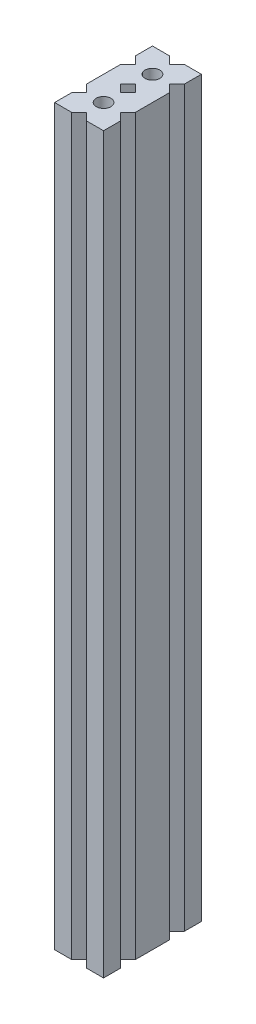
from build123d import *

# Parameters (mm, degrees)
SKIZZE1_W                       = 20
SKIZZE1_H                       = 40
AUFSATZ_LINEAR_AUSTRAGEN1_DEPTH = 300
SCHNITT_LINEAR_AUSTRAGEN1_DEPTH = 304.315017762
SKIZZE3_R                       = 3
SCHNITT_LINEAR_AUSTRAGEN2_DEPTH = 304.315017762


with BuildPart() as part:
    # Skizze1 → Aufsatz-Linear austragen1 (new body)
    with BuildSketch(Plane(origin=(0, 0, 0), x_dir=(1, 0, 0), z_dir=(0, 1, 0))):
        with Locations((10, 20)):
            Rectangle(SKIZZE1_W, SKIZZE1_H)
    extrude(amount=AUFSATZ_LINEAR_AUSTRAGEN1_DEPTH)

    # Skizze2 → Schnitt-Linear austragen1 (cut, through all)
    with BuildSketch(Plane(origin=(0, 300, 0), x_dir=(1, 0, 0), z_dir=(0, 1, 0))):
        Polygon((3, 30), (0, 33), (0, 27), align=None)
        Polygon((13, 40), (7, 40), (10, 37), align=None)
        Polygon((20, 27), (20, 33), (17, 30), align=None)
        Polygon((13, 20), (10, 17), (7, 20), align=None)
        Polygon((7, 20), (10, 23), (13, 20), align=None)
        Polygon((20, 7), (20, 13), (17, 10), align=None)
        Polygon((3, 10), (0, 13), (0, 7), align=None)
        Polygon((10, 3), (7, 0), (13, 0), align=None)
    extrude(amount=-SCHNITT_LINEAR_AUSTRAGEN1_DEPTH, mode=Mode.SUBTRACT)

    # Skizze3 → Schnitt-Linear austragen2 (cut, through all)
    with BuildSketch(Plane.XZ):
        with Locations(Location((10, -10, 0), (0, 0, 270))):
            Circle(SKIZZE3_R)
        with Locations(Location((10, -30, 0), (0, 0, 90))):
            Circle(SKIZZE3_R)
    extrude(amount=-SCHNITT_LINEAR_AUSTRAGEN2_DEPTH, mode=Mode.SUBTRACT)


solid = part.part
